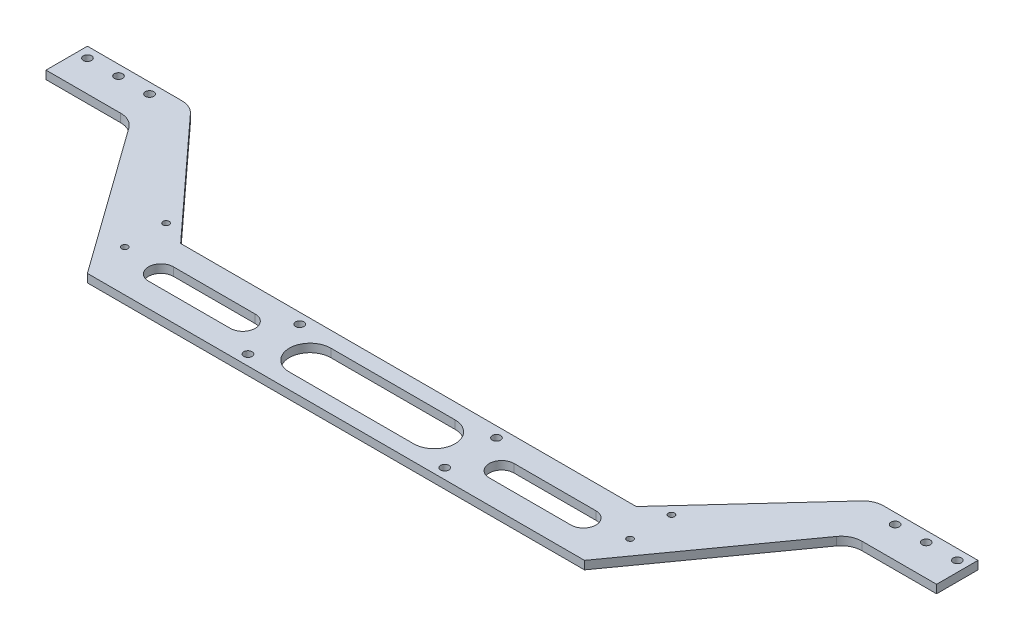
from build123d import *

# Parameters (mm, degrees)
SKETCH_2_R          = 2
EXTRUDE_1_DEPTH     = 4
SKETCH_3_R          = 1.5
CUT_EXTRUDE_1_DEPTH = 10
FILLET_1_R          = 10
CUT_EXTRUDE_2_DEPTH = 278.528827332


with BuildPart() as part:
    # 草图2 → 凸台-拉伸1 (new body)
    with BuildSketch(Plane(origin=(0, 0, 0), x_dir=(1, 0, 0), z_dir=(0, 1, 0))):
        Polygon((-72.5, -5), (167.5, -5), (221.298034327, 70), (262.5, 70), (262.5, 90), (212.5, 90), (157.5, 30), (-62.5, 30), (-117.5, 90), (-167.5, 90), (-167.5, 70), (-126.298034327, 70), align=None)
        with Locations(Location((0, 0, 0), (0, 0, 270))):
            Circle(SKETCH_2_R, mode=Mode.SUBTRACT)
        with Locations(Location((95, 0, 0), (0, 0, 270))):
            Circle(SKETCH_2_R, mode=Mode.SUBTRACT)
        with Locations(Location((95, 25, 0), (0, 0, 270))):
            Circle(SKETCH_2_R, mode=Mode.SUBTRACT)
        with Locations(Location((0, 25, 0), (0, 0, 270))):
            Circle(SKETCH_2_R, mode=Mode.SUBTRACT)
        with Locations(Location((-162.5, 85, 0), (0, 0, 270))):
            Circle(SKETCH_2_R, mode=Mode.SUBTRACT)
        with Locations(Location((-147.5, 85, 0), (0, 0, 270))):
            Circle(SKETCH_2_R, mode=Mode.SUBTRACT)
        with Locations(Location((-132.5, 85, 0), (0, 0, 270))):
            Circle(SKETCH_2_R, mode=Mode.SUBTRACT)
        with Locations(Location((227.5, 85, 0), (0, 0, 90))):
            Circle(SKETCH_2_R, mode=Mode.SUBTRACT)
        with Locations(Location((242.5, 85, 0), (0, 0, 90))):
            Circle(SKETCH_2_R, mode=Mode.SUBTRACT)
        with Locations(Location((257.5, 85, 0), (0, 0, 90))):
            Circle(SKETCH_2_R, mode=Mode.SUBTRACT)
        with BuildLine():
            Line((77.5, 2.5), (17.5, 2.5))
            ThreePointArc((17.5, 2.5), (7.5, 12.5), (17.5, 22.5))
            Line((17.5, 22.5), (77.5, 22.5))
            ThreePointArc((77.5, 22.5), (87.5, 12.5), (77.5, 2.5))
        make_face(mode=Mode.SUBTRACT)
    extrude(amount=EXTRUDE_1_DEPTH)

    # 草图3 → 切除-拉伸1 (cut)
    with BuildSketch(Plane.XZ):
        with Locations(Location((169.5, -35, 0), (0, 0, 270))):
            Circle(SKETCH_3_R)
        with Locations(Location((169.5, -15, 0), (0, 0, 270))):
            Circle(SKETCH_3_R)
        with Locations(Location((-74.5, -15, 0), (0, 0, 270))):
            Circle(SKETCH_3_R)
        with Locations(Location((-74.5, -35, 0), (0, 0, 270))):
            Circle(SKETCH_3_R)
    extrude(amount=-CUT_EXTRUDE_1_DEPTH, mode=Mode.SUBTRACT)

    # 圆角1
    fillet_1_edges = [part.edges().sort_by_distance(p)[0] for p in [
        (212.5, 2, -90),
        (221.298034327, 2, -70),
        (-126.298034327, 2, -70),
        (-117.5, 2, -90),
    ]]
    fillet(fillet_1_edges, radius=FILLET_1_R)

    # 草图4 → 切除-拉伸2 (cut, through all)
    with BuildSketch(Plane(origin=(0, 4, 0), x_dir=(1, 0, 0), z_dir=(0, 1, 0))):
        with BuildLine():
            Line((-54.5, 18.5), (-15, 18.5))
            ThreePointArc((-15, 18.5), (-9, 12.5), (-15, 6.5))
            Line((-15, 6.5), (-54.5, 6.5))
            ThreePointArc((-54.5, 6.5), (-60.5, 12.5), (-54.5, 18.5))
        make_face()
        with BuildLine():
            Line((149.5, 18.5), (110, 18.5))
            ThreePointArc((110, 18.5), (104, 12.5), (110, 6.5))
            Line((110, 6.5), (149.5, 6.5))
            ThreePointArc((149.5, 6.5), (155.5, 12.5), (149.5, 18.5))
        make_face()
    extrude(amount=-CUT_EXTRUDE_2_DEPTH, mode=Mode.SUBTRACT)


solid = part.part
